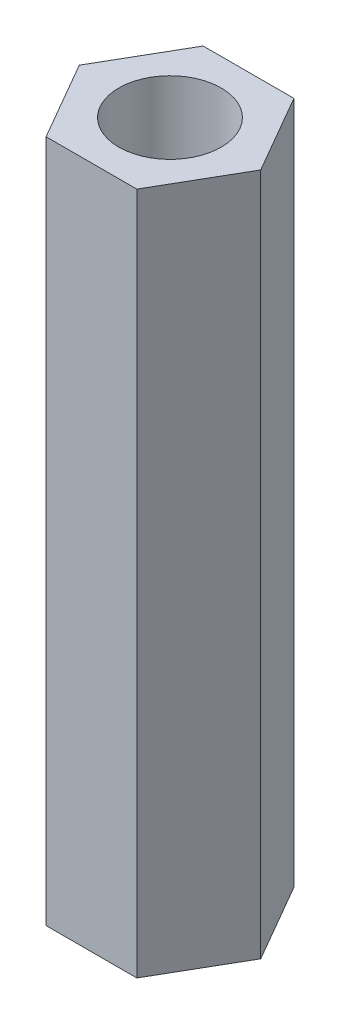
from build123d import *

# Parameters (mm, degrees)
SKETCH_1_R      = 1.5
EXTRUDE_1_DEPTH = 20


with BuildPart() as part:
    # 草图1 → 凸台-拉伸1 (new body)
    with BuildSketch(Plane(origin=(0, 0, 0), x_dir=(1, 0, 0), z_dir=(0, 1, 0))):
        Polygon((1.327905619, -2.3), (2.655811238, 0), (1.327905619, 2.3), (-1.327905619, 2.3), (-2.655811238, 0), (-1.327905619, -2.3), align=None)
        with Locations(Location((0, 0, 0), (0, 0, 270))):
            Circle(SKETCH_1_R, mode=Mode.SUBTRACT)
    extrude(amount=EXTRUDE_1_DEPTH)


solid = part.part
